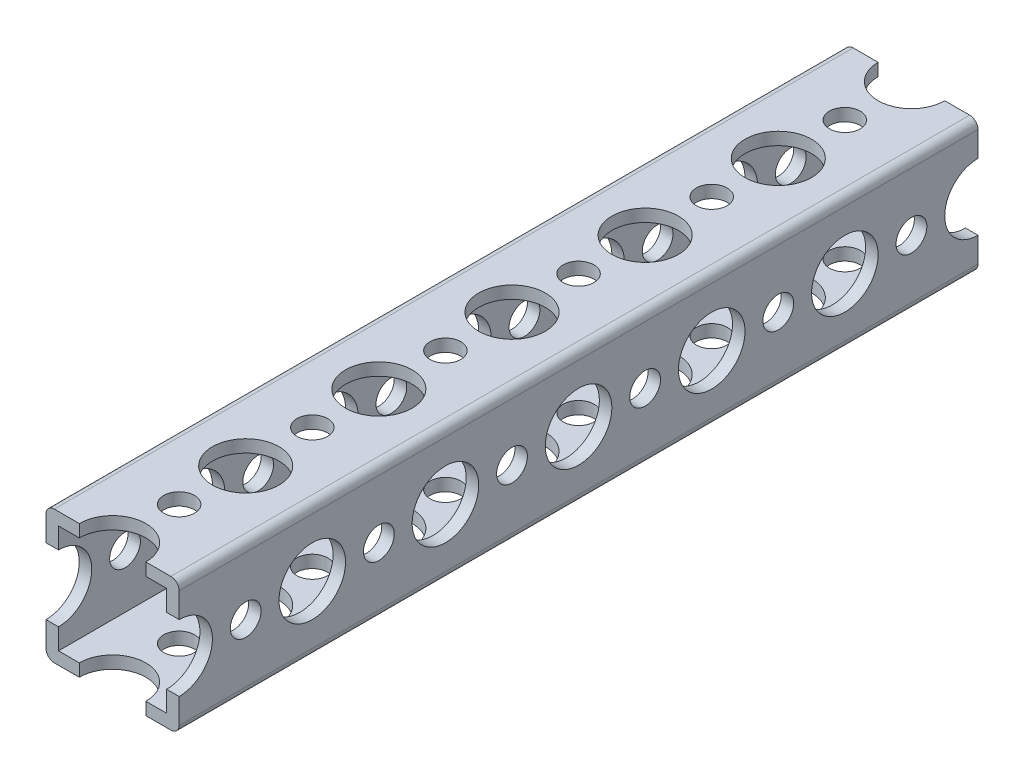
from build123d import *

# Parameters (mm, degrees)
SKETCH1_W      = 16
SKETCH1_H      = 16
EXTRUDE1_DEPTH = 96
SKETCH2_W      = 13
SKETCH2_H      = 13
EXTRUDE2_DEPTH = 99.630624048
SKETCH3_R      = 4
SKETCH3_R_2    = 1.85
EXTRUDE3_DEPTH = 99.630624048
SKETCH4_R      = 4
SKETCH4_R_2    = 1.85
EXTRUDE4_DEPTH = 99.630624048
FILLET1_R      = 1


with BuildPart() as part:
    # Sketch1 → Extrude1 (new body)
    with BuildSketch(Plane.XY):
        with Locations((8, 8)):
            Rectangle(SKETCH1_W, SKETCH1_H)
    extrude(amount=-EXTRUDE1_DEPTH)

    # Sketch2 → Extrude2 (cut, through all)
    with BuildSketch(Plane.XY):
        with Locations((8, 8)):
            Rectangle(SKETCH2_W, SKETCH2_H)
    extrude(amount=-EXTRUDE2_DEPTH, mode=Mode.SUBTRACT)

    # Sketch3 → Extrude3 (cut, through all)
    with BuildSketch(Plane(origin=(0, 16, 0), x_dir=(1, 0, 0), z_dir=(0, 1, 0))):
        with Locations(Location((8, 64, 0), (0, 0, 270))):
            Circle(SKETCH3_R)
        with Locations(Location((8, 32, 0), (0, 0, 270))):
            Circle(SKETCH3_R)
        with Locations((8, 0)):
            Circle(SKETCH3_R)
        with Locations((8, 96)):
            Circle(SKETCH3_R)
        with Locations((8, 128)):
            Circle(SKETCH3_R)
        with Locations((8, 160)):
            Circle(SKETCH3_R)
        with Locations((8, 192)):
            Circle(SKETCH3_R)
        with Locations((8, 224)):
            Circle(SKETCH3_R)
        with Locations((8, 256)):
            Circle(SKETCH3_R)
        with Locations(Location((8, 48, 0), (0, 0, 270))):
            Circle(SKETCH3_R)
        with Locations(Location((8, 56, 0), (0, 0, 270))):
            Circle(SKETCH3_R_2)
        with Locations(Location((8, 40, 0), (0, 0, 270))):
            Circle(SKETCH3_R_2)
        with Locations(Location((8, 80, 0), (0, 0, 270))):
            Circle(SKETCH3_R)
        with Locations(Location((8, 88, 0), (0, 0, 270))):
            Circle(SKETCH3_R_2)
        with Locations(Location((8, 72, 0), (0, 0, 270))):
            Circle(SKETCH3_R_2)
        with Locations(Location((8, 16, 0), (0, 0, 270))):
            Circle(SKETCH3_R)
        with Locations(Location((8, 24, 0), (0, 0, 270))):
            Circle(SKETCH3_R_2)
        with Locations(Location((8, 8, 0), (0, 0, 270))):
            Circle(SKETCH3_R_2)
        with Locations((8, 112)):
            Circle(SKETCH3_R)
        with Locations((8, 120)):
            Circle(SKETCH3_R_2)
        with Locations((8, 104)):
            Circle(SKETCH3_R_2)
        with Locations((8, 144)):
            Circle(SKETCH3_R)
        with Locations((8, 152)):
            Circle(SKETCH3_R_2)
        with Locations((8, 136)):
            Circle(SKETCH3_R_2)
        with Locations((8, 176)):
            Circle(SKETCH3_R)
        with Locations((8, 184)):
            Circle(SKETCH3_R_2)
        with Locations((8, 168)):
            Circle(SKETCH3_R_2)
        with Locations((8, 208)):
            Circle(SKETCH3_R)
        with Locations((8, 216)):
            Circle(SKETCH3_R_2)
        with Locations((8, 200)):
            Circle(SKETCH3_R_2)
        with Locations((8, 240)):
            Circle(SKETCH3_R)
        with Locations((8, 248)):
            Circle(SKETCH3_R_2)
        with Locations((8, 232)):
            Circle(SKETCH3_R_2)
    extrude(amount=-EXTRUDE3_DEPTH, mode=Mode.SUBTRACT)

    # Sketch4 → Extrude4 (cut, through all)
    with BuildSketch(Plane(origin=(16, 0, 0), x_dir=(0, 0, -1), z_dir=(1, 0, 0))):
        with Locations(Location((32, 8, 0), (0, 0, 90))):
            Circle(SKETCH4_R)
        with Locations(Location((64, 8, 0), (0, 0, 90))):
            Circle(SKETCH4_R)
        with Locations((0, 8)):
            Circle(SKETCH4_R)
        with Locations((96, 8)):
            Circle(SKETCH4_R)
        with Locations((128, 8)):
            Circle(SKETCH4_R)
        with Locations((160, 8)):
            Circle(SKETCH4_R)
        with Locations((192, 8)):
            Circle(SKETCH4_R)
        with Locations((224, 8)):
            Circle(SKETCH4_R)
        with Locations((256, 8)):
            Circle(SKETCH4_R)
        with Locations(Location((48, 8.074203, 0), (0, 0, 90))):
            Circle(SKETCH4_R)
        with Locations(Location((40, 8.074203, 0), (0, 0, 90))):
            Circle(SKETCH4_R_2)
        with Locations(Location((56, 8.074203, 0), (0, 0, 90))):
            Circle(SKETCH4_R_2)
        with Locations(Location((80, 8, 0), (0, 0, 90))):
            Circle(SKETCH4_R)
        with Locations(Location((72, 8, 0), (0, 0, 90))):
            Circle(SKETCH4_R_2)
        with Locations(Location((88, 8, 0), (0, 0, 90))):
            Circle(SKETCH4_R_2)
        with Locations(Location((16, 8, 0), (0, 0, 90))):
            Circle(SKETCH4_R)
        with Locations(Location((8, 8, 0), (0, 0, 90))):
            Circle(SKETCH4_R_2)
        with Locations(Location((24, 8, 0), (0, 0, 90))):
            Circle(SKETCH4_R_2)
        with Locations((112, 8)):
            Circle(SKETCH4_R)
        with Locations((104, 8)):
            Circle(SKETCH4_R_2)
        with Locations((120, 8)):
            Circle(SKETCH4_R_2)
        with Locations((144, 8)):
            Circle(SKETCH4_R)
        with Locations((136, 8)):
            Circle(SKETCH4_R_2)
        with Locations((152, 8)):
            Circle(SKETCH4_R_2)
        with Locations((176, 8)):
            Circle(SKETCH4_R)
        with Locations((168, 8)):
            Circle(SKETCH4_R_2)
        with Locations((184, 8)):
            Circle(SKETCH4_R_2)
        with Locations((208, 8)):
            Circle(SKETCH4_R)
        with Locations((200, 8)):
            Circle(SKETCH4_R_2)
        with Locations((216, 8)):
            Circle(SKETCH4_R_2)
        with Locations((240, 8)):
            Circle(SKETCH4_R)
        with Locations((232, 8)):
            Circle(SKETCH4_R_2)
        with Locations((248, 8)):
            Circle(SKETCH4_R_2)
    extrude(amount=-EXTRUDE4_DEPTH, mode=Mode.SUBTRACT)

    # Fillet1
    fillet1_edges = [part.edges().sort_by_distance(p)[0] for p in [
        (0, 16, -48),
        (16, 16, -48),
        (16, 0, -48),
        (0, 0, -48),
    ]]
    fillet(fillet1_edges, radius=FILLET1_R)


solid = part.part
